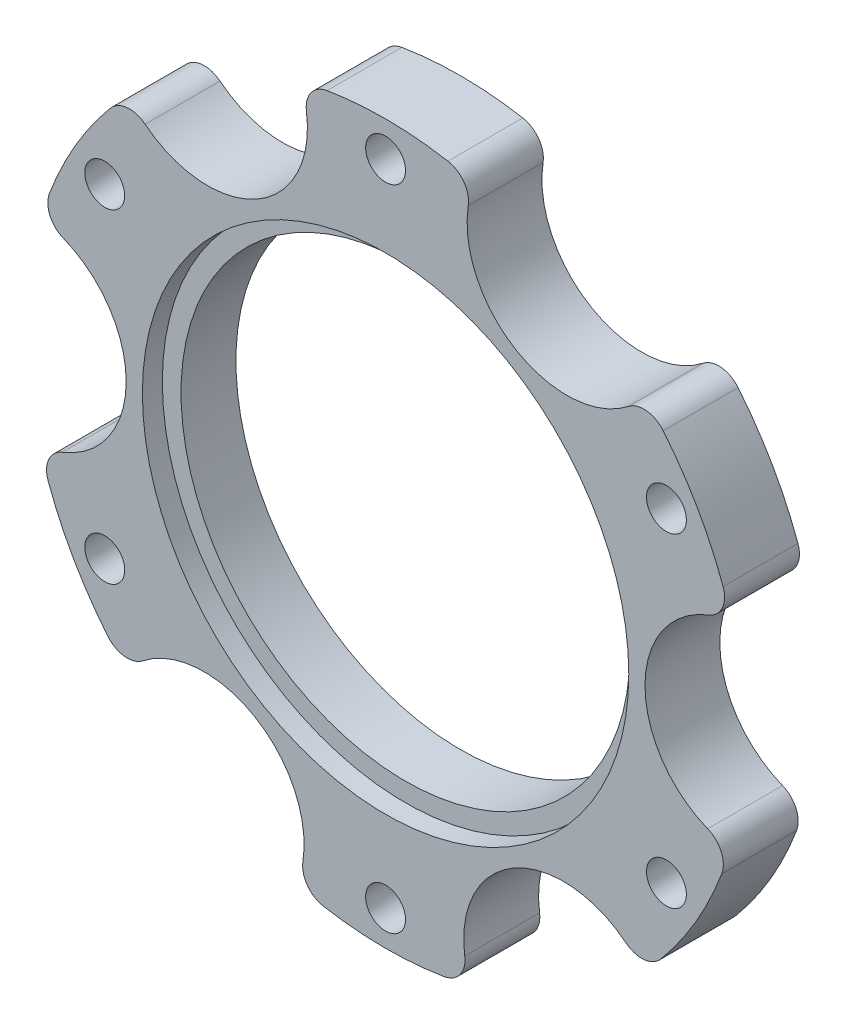
from build123d import *

# Parameters (mm, degrees)
SKETCH_1_R          = 14.4
SKETCH_1_R_2        = 9
EXTRUDE_1_DEPTH     = 3
SKETCH_2_R          = 9.75
CUT_EXTRUDE_1_DEPTH = 0.8
SKETCH_3_R          = 0.8
CUT_EXTRUDE_2_DEPTH = 10
SKETCH_4_R          = 4
CUT_EXTRUDE_3_DEPTH = 10
FILLET_1_R          = 1


with BuildPart() as part:
    # 草图1 → 凸台-拉伸1 (new body)
    with BuildSketch(Plane.XY):
        Circle(SKETCH_1_R)
        Circle(SKETCH_1_R_2, mode=Mode.SUBTRACT)
    extrude(amount=EXTRUDE_1_DEPTH)

    # 草图2 → 切除-拉伸1 (cut)
    with BuildSketch(Plane.XY.offset(3)):
        Circle(SKETCH_2_R)
    extrude(amount=-CUT_EXTRUDE_1_DEPTH, mode=Mode.SUBTRACT)

    # 草图3 → 切除-拉伸2 (cut)
    with BuildSketch(Plane.XY.offset(3)):
        with Locations((0, 13)):
            Circle(SKETCH_3_R)
        with Locations((11.258330249, 6.5)):
            Circle(SKETCH_3_R)
        with Locations((11.258330249, -6.5)):
            Circle(SKETCH_3_R)
        with Locations((0, -13)):
            Circle(SKETCH_3_R)
        with Locations((-11.258330249, -6.5)):
            Circle(SKETCH_3_R)
        with Locations((-11.258330249, 6.5)):
            Circle(SKETCH_3_R)
    extrude(amount=-CUT_EXTRUDE_2_DEPTH, mode=Mode.SUBTRACT)

    # 草图4 → 切除-拉伸3 (cut)
    with BuildSketch(Plane.XY.offset(3)):
        with Locations((7.267001819, 12.431841559)):
            Circle(SKETCH_4_R)
        with Locations((14.399791516, -0.077487405)):
            Circle(SKETCH_4_R)
        with Locations((7.132789697, -12.509328965)):
            Circle(SKETCH_4_R)
        with Locations((-7.267001819, -12.431841559)):
            Circle(SKETCH_4_R)
        with Locations((-14.399791516, 0.077487405)):
            Circle(SKETCH_4_R)
        with Locations((-7.132789697, 12.509328965)):
            Circle(SKETCH_4_R)
    extrude(amount=-CUT_EXTRUDE_3_DEPTH, mode=Mode.SUBTRACT)

    # 圆角1
    fillet_1_edges = [part.edges().sort_by_distance(p)[0] for p in [
        (3.566819155, 13.951265216, 1.5),
        (10.406459035, 9.953170869, 1.5),
        (13.865559669, 3.886676609, 1.5),
        (13.822928338, -4.035672453, 1.5),
        (10.298740514, -10.064588606, 1.5),
        (3.416469303, -13.988843322, 1.5),
        (-3.566819155, -13.951265216, 1.5),
        (-10.406459035, -9.953170869, 1.5),
        (-13.865559669, -3.886676609, 1.5),
        (-13.822928338, 4.035672453, 1.5),
        (-10.298740514, 10.064588606, 1.5),
        (-3.416469303, 13.988843322, 1.5),
    ]]
    fillet(fillet_1_edges, radius=FILLET_1_R)


solid = part.part
